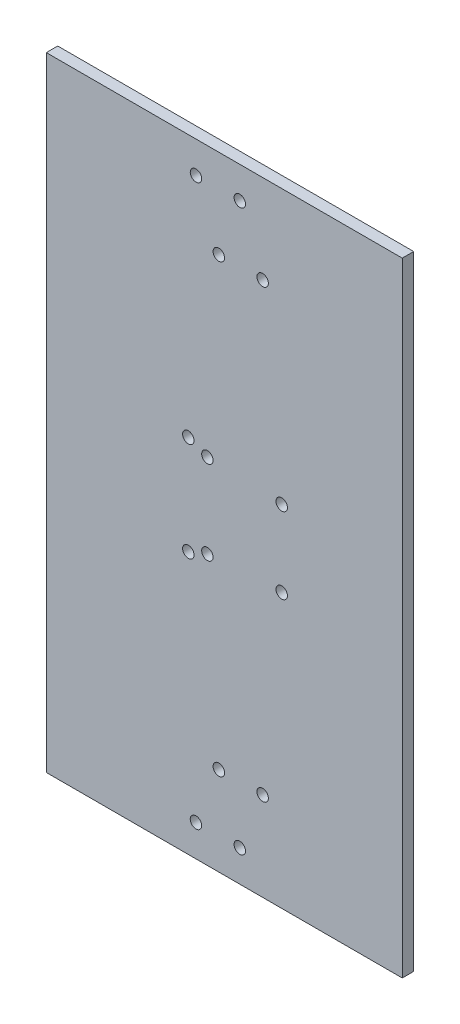
from build123d import *

# Parameters (mm, degrees)
SZKIC1_W                    = 93.394041507
SZKIC1_H                    = 81.79044571
SZKIC1_R                    = 1.5
DODANIE_WYCI_GNI_CIE2_DEPTH = 3


with BuildPart() as part:
    # Szkic1 → Dodanie-wyciągnięcie2 (new body)
    with BuildSketch(Plane.XY):
        with Locations((3.432858123, 40.895222855)):
            Rectangle(SZKIC1_W, SZKIC1_H)
        with Locations((-1, 11)):
            Circle(SZKIC1_R, mode=Mode.SUBTRACT)
        with Locations((18.5, 10)):
            Circle(SZKIC1_R, mode=Mode.SUBTRACT)
        with Locations((-6, 13)):
            Circle(SZKIC1_R, mode=Mode.SUBTRACT)
        with Locations((2, 58.5)):
            Circle(SZKIC1_R, mode=Mode.SUBTRACT)
        with Locations((13.5, 58.5)):
            Circle(SZKIC1_R, mode=Mode.SUBTRACT)
        with Locations((-4, 73.5)):
            Circle(SZKIC1_R, mode=Mode.SUBTRACT)
        with Locations((7.5, 73.5)):
            Circle(SZKIC1_R, mode=Mode.SUBTRACT)
    dodanie_wyci_gni_cie2 = extrude(amount=DODANIE_WYCI_GNI_CIE2_DEPTH)

    # Lustro4: Dodanie-wyciągnięcie2 across plane
    add(dodanie_wyci_gni_cie2.mirror(Plane.ZX))


solid = part.part
